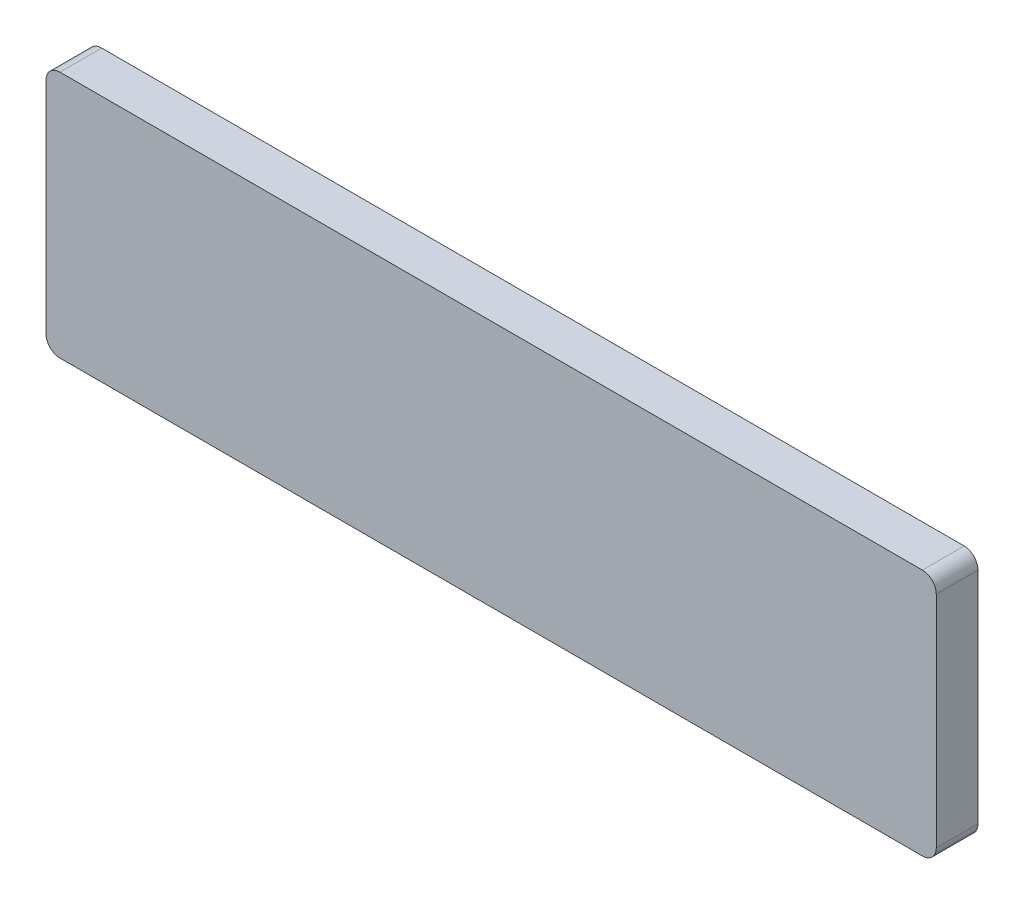
from build123d import *

# Parameters (mm, degrees)
BOSS_EXTRUDE1_DEPTH = 7.5


with BuildPart() as part:
    # Sketch1 → Boss-Extrude1 (new, symmetric)
    with BuildSketch(Plane.XY):
        with BuildLine():
            Line((-155, 44.5), (155, 44.5))
            ThreePointArc((155, 44.5), (158.535533906, 43.035533906), (160, 39.5))
            Line((160, 39.5), (160, -39.5))
            ThreePointArc((160, -39.5), (158.535533906, -43.035533906), (155, -44.5))
            Line((155, -44.5), (-155, -44.5))
            ThreePointArc((-155, -44.5), (-158.535533906, -43.035533906), (-160, -39.5))
            Line((-160, -39.5), (-160, 39.5))
            ThreePointArc((-160, 39.5), (-158.535533906, 43.035533906), (-155, 44.5))
        make_face()
    extrude(amount=BOSS_EXTRUDE1_DEPTH, both=True)


solid = part.part
